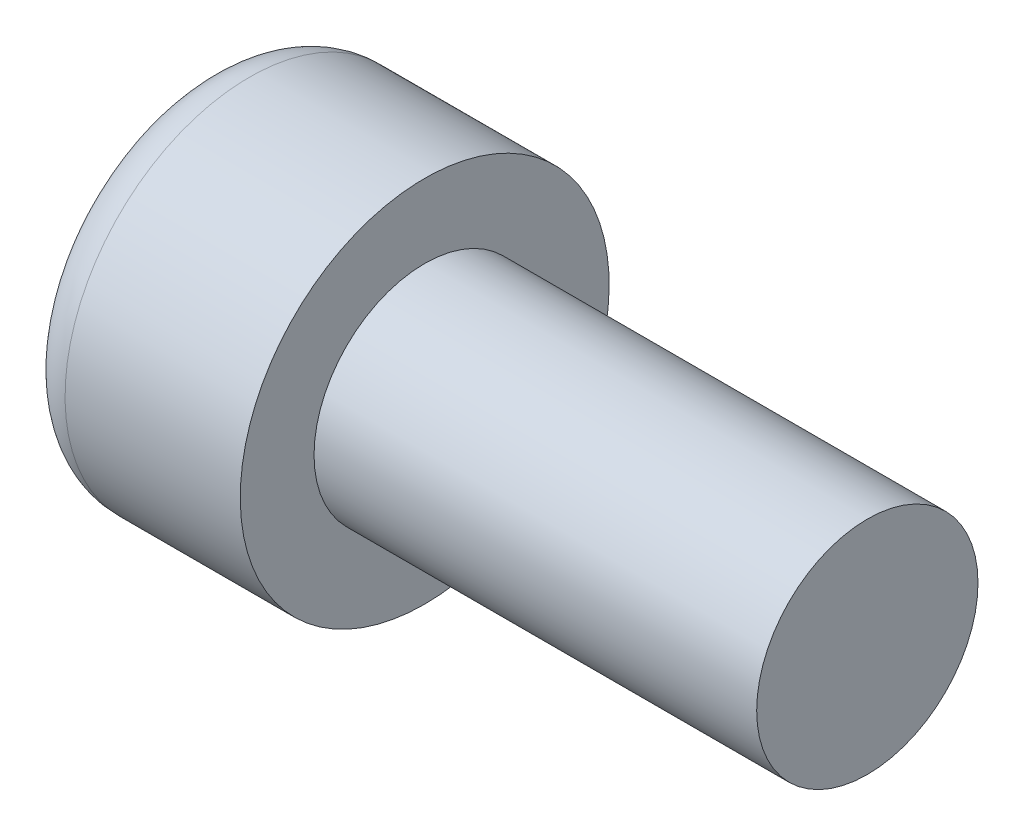
from build123d import *

# Parameters (mm, degrees)
CUT_EXTRUDE1_DEPTH = 3.5


with BuildPart() as part:
    # Sketch1 → Revolve1 (revolve)
    with BuildSketch(Plane.XY, mode=Mode.PRIVATE) as revolve1_sk:
        with BuildLine():
            Line((0, 0), (0, 3.75))
            ThreePointArc((0, 3.75), (0.366116524, 4.633883476), (1.25, 5))
            Line((1.25, 5), (6, 5))
            Line((6, 5), (6, 3))
            Line((6, 3), (18, 3))
            Line((18, 3), (18, 0))
            Line((18, 0), (0, 0))
        make_face()
    revolve(revolve1_sk.sketch.rotate(Axis((0, 0, 0), (1, 0, 0)), 180), axis=Axis((0, 0, 0), (1, 0, 0)))

    # Sketch2 → Cut-Extrude1 (cut)
    with BuildSketch(Plane.ZY):
        Polygon((0, 2.886751346), (-2.5, 1.443375673), (-2.5, -1.443375673), (0, -2.886751346), (2.5, -1.443375673), (2.5, 1.443375673), align=None)
    extrude(amount=-CUT_EXTRUDE1_DEPTH, mode=Mode.SUBTRACT)


solid = part.part
